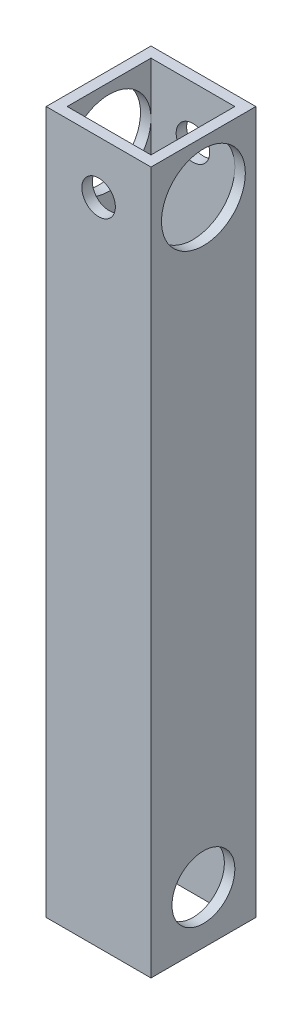
from build123d import *

# Parameters (mm, degrees)
SKETCH_1_W          = 10
SKETCH_1_H          = 10
SKETCH_1_W_2        = 8
SKETCH_1_H_2        = 8
EXTRUDE_1_DEPTH     = 67
CUT_EXTRUDE_1_REACH = 70.476
SKETCH_2_R          = 1.6
CUT_EXTRUDE_2_REACH = 70.476
SKETCH_3_R          = 4
SKETCH_3_R_2        = 3


with BuildPart() as part:
    # ｽｹｯﾁ1 → 押し出し-薄板1 (new body)
    with BuildSketch(Plane(origin=(0, 0, 0), x_dir=(1, 0, 0), z_dir=(0, 1, 0))):
        with Locations((5, 5)):
            Rectangle(SKETCH_1_W, SKETCH_1_H)
        with Locations((5, 5)):
            Rectangle(SKETCH_1_W_2, SKETCH_1_H_2, mode=Mode.SUBTRACT)
    extrude(amount=EXTRUDE_1_DEPTH)

    # ｶｯﾄ - 押し出し1: up to this face of the body (flat: up to its plane)
    cut_extrude_1_end = Plane(part.part.faces().sort_by_distance((5, 33.5, -10))[0])
    # ｽｹｯﾁ2 → ｶｯﾄ - 押し出し1 (cut, up to the picked face)
    with BuildSketch(Plane.XY, mode=Mode.PRIVATE) as cut_extrude_1_sk1:
        with Locations((5, 62)):
            Circle(SKETCH_2_R)
    cut_extrude_1_tool1 = split(extrude(cut_extrude_1_sk1.sketch, amount=-CUT_EXTRUDE_1_REACH, mode=Mode.PRIVATE), bisect_by=cut_extrude_1_end, keep=Keep.BOTH, mode=Mode.PRIVATE)
    add(cut_extrude_1_tool1.solids().sort_by(Axis((5, 62, 0), (0, 0, -1)))[0], mode=Mode.SUBTRACT)

    # ｶｯﾄ - 押し出し2: up to this face of the body (flat: up to its plane)
    cut_extrude_2_end = Plane(part.part.faces().sort_by_distance((0, 33.5, -5))[0])
    # ｽｹｯﾁ3 → ｶｯﾄ - 押し出し2 (cut, up to the picked face)
    with BuildSketch(Plane(origin=(10, 0, 0), x_dir=(0, 0, -1), z_dir=(1, 0, 0)), mode=Mode.PRIVATE) as cut_extrude_2_sk1:
        with Locations((5, 62)):
            Circle(SKETCH_3_R)
    cut_extrude_2_tool1 = split(extrude(cut_extrude_2_sk1.sketch, amount=-CUT_EXTRUDE_2_REACH, mode=Mode.PRIVATE), bisect_by=cut_extrude_2_end, keep=Keep.BOTH, mode=Mode.PRIVATE)
    # ｽｹｯﾁ3 → ｶｯﾄ - 押し出し2 (cut, up to the picked face)
    with BuildSketch(Plane(origin=(10, 0, 0), x_dir=(0, 0, -1), z_dir=(1, 0, 0)), mode=Mode.PRIVATE) as cut_extrude_2_sk2:
        with Locations((5, 5)):
            Circle(SKETCH_3_R_2)
    cut_extrude_2_tool2 = split(extrude(cut_extrude_2_sk2.sketch, amount=-CUT_EXTRUDE_2_REACH, mode=Mode.PRIVATE), bisect_by=cut_extrude_2_end, keep=Keep.BOTH, mode=Mode.PRIVATE)
    add(cut_extrude_2_tool1.solids().sort_by(Axis((10, 62, -5), (-1, 0, 0)))[0], mode=Mode.SUBTRACT)
    add(cut_extrude_2_tool2.solids().sort_by(Axis((10, 5, -5), (-1, 0, 0)))[0], mode=Mode.SUBTRACT)


solid = part.part
